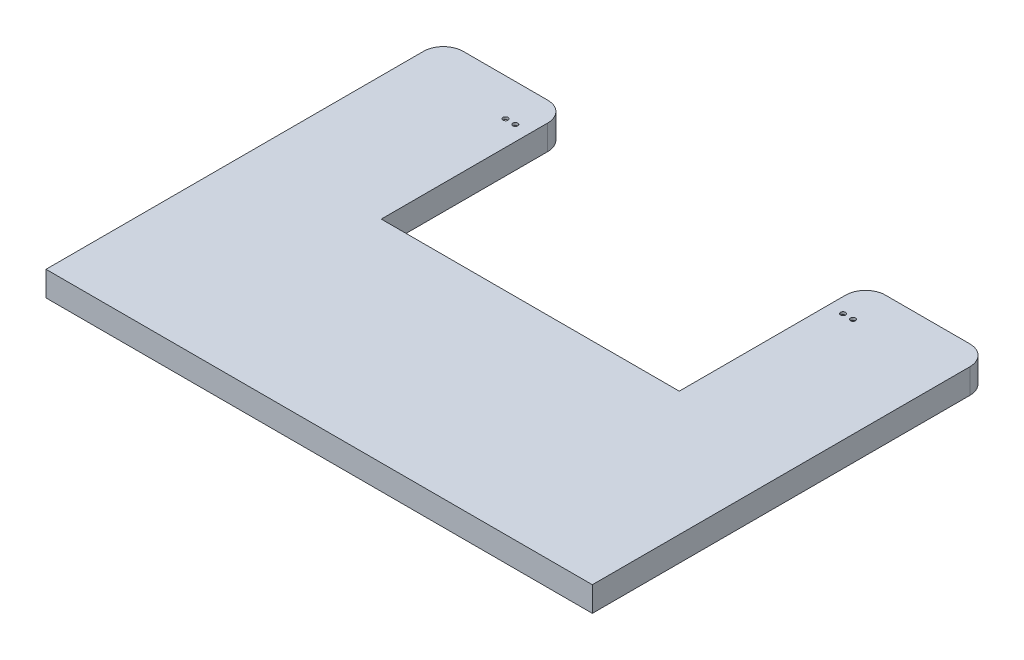
from build123d import *

# Parameters (mm, degrees)
BOSS_EXTRUDE1_DEPTH = 25.4
FILLET1_R           = 20.32
SHELL1_T            = -2.54
SKETCH2_R           = 2.54
CUT_EXTRUDE1_DEPTH  = 347.409815103


with BuildPart() as part:
    # Sketch1 → Boss-Extrude1 (new body)
    with BuildSketch(Plane(origin=(0, 0, 0), x_dir=(1, 0, 0), z_dir=(0, 1, 0))):
        Polygon((-279.4, 203.2), (-279.4, -203.2), (279.4, -203.2), (279.4, 203.2), (152.4, 203.2), (152.4, 12.7), (-152.4, 12.7), (-152.4, 203.2), align=None)
    extrude(amount=BOSS_EXTRUDE1_DEPTH)

    # Fillet1
    fillet1_edges = [part.edges().sort_by_distance(p)[0] for p in [
        (279.4, 12.7, -203.2),
        (-279.4, 12.7, -203.2),
        (-152.4, 12.7, -203.2),
        (152.4, 12.7, -203.2),
    ]]
    fillet(fillet1_edges, radius=FILLET1_R)

    # Shell1
    shell1_openings = [part.faces().sort_by_distance(p)[0] for p in [
        (0, 0, 37.577423361),
    ]]
    offset(amount=SHELL1_T, openings=shell1_openings, kind=Kind.INTERSECTION)

    # Sketch2 → Cut-Extrude1 (cut, through all)
    with BuildSketch(Plane(origin=(0, 25.4, 0), x_dir=(1, 0, 0), z_dir=(0, 1, 0))):
        with Locations(Location((-177.72, 165.1, 0), (0, 0, 270))):
            Circle(SKETCH2_R)
        with Locations(Location((-167.56, 165.1, 0), (0, 0, 270))):
            Circle(SKETCH2_R)
        with Locations(Location((167.56, 165.1, 0), (0, 0, 270))):
            Circle(SKETCH2_R)
        with Locations(Location((177.72, 165.1, 0), (0, 0, 270))):
            Circle(SKETCH2_R)
    extrude(amount=-CUT_EXTRUDE1_DEPTH, mode=Mode.SUBTRACT)


solid = part.part
